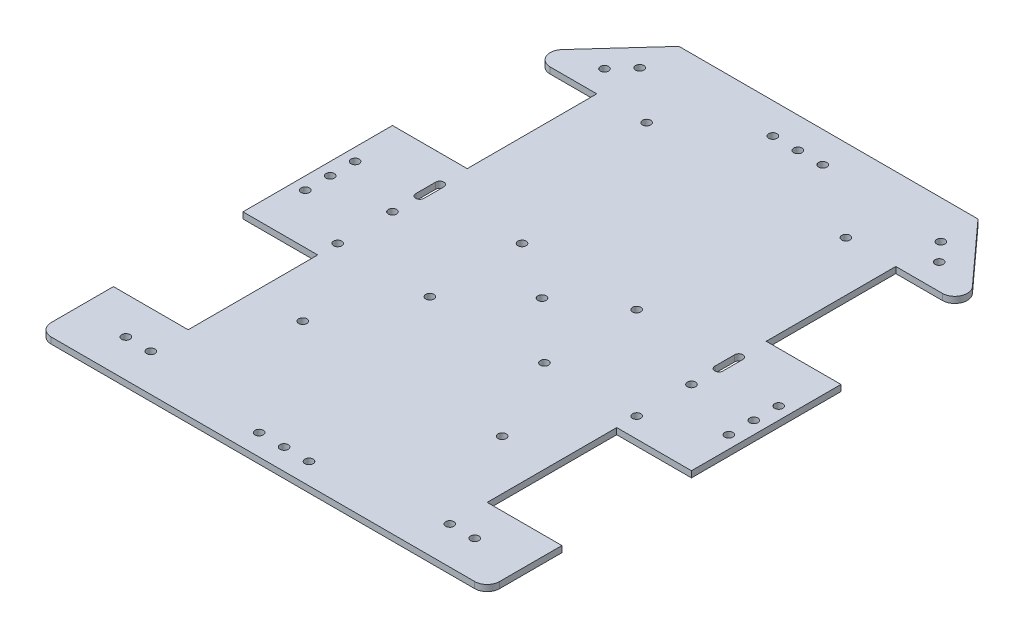
from build123d import *

# Parameters (mm, degrees)
BOSS_EXTRUDE1_DEPTH = 2.5
FILLET1_R           = 5
FILLET2_R           = 5
SKETCH2_R           = 1.65
CUT_EXTRUDE1_DEPTH  = 232.152006264
SKETCH3_R           = 1.65
CUT_EXTRUDE2_DEPTH  = 10
SKETCH4_R           = 1.65
CUT_EXTRUDE3_DEPTH  = 10
SKETCH5_R           = 1.65
CUT_EXTRUDE4_DEPTH  = 10
SKETCH6_R           = 1.65
CUT_EXTRUDE5_DEPTH  = 10
SKETCH8_R           = 1.65
CUT_EXTRUDE6_DEPTH  = 10
SKETCH9_R           = 1.65
CUT_EXTRUDE7_DEPTH  = 10


with BuildPart() as part:
    # Sketch1 → Boss-Extrude1 (new body)
    with BuildSketch(Plane(origin=(0, 0, 0), x_dir=(1, 0, 0), z_dir=(0, 1, 0))):
        Polygon((0, 0), (0, 60), (30, 60), (30, 112), (0, 112), (30, 145), (150, 145), (180, 112), (150, 112), (150, 60), (180, 60), (180, 0), (150, 0), (150, -52), (180, -52), (180, -82), (0, -82), (0, -52), (30, -52), (30, 0), align=None)
    extrude(amount=BOSS_EXTRUDE1_DEPTH)

    # Fillet1
    fillet1_edges = [part.edges().sort_by_distance(p)[0] for p in [
        (180, 1.25, 82),
        (0, 1.25, 82),
    ]]
    fillet(fillet1_edges, radius=FILLET1_R)

    # Fillet2
    fillet2_edges = [part.edges().sort_by_distance(p)[0] for p in [
        (0, 1.25, -112),
        (180, 1.25, -112),
    ]]
    fillet(fillet2_edges, radius=FILLET2_R)

    # Sketch2 → Cut-Extrude1 (cut, through all)
    with BuildSketch(Plane(origin=(0, 2.5, 0), x_dir=(1, 0, 0), z_dir=(0, 1, 0))):
        with Locations(Location((30, 30, 0), (0, 0, 270))):
            Circle(SKETCH2_R)
        with Locations(Location((30, -67, 0), (0, 0, 270))):
            Circle(SKETCH2_R)
        with Locations(Location((50, 112, 0), (0, 0, 270))):
            Circle(SKETCH2_R)
        with Locations(Location((50, -26, 0), (0, 0, 270))):
            Circle(SKETCH2_R)
        with Locations(Location((150, -67, 0), (0, 0, 90))):
            Circle(SKETCH2_R)
        with Locations(Location((130, -26, 0), (0, 0, 90))):
            Circle(SKETCH2_R)
        with Locations(Location((150, 30, 0), (0, 0, 90))):
            Circle(SKETCH2_R)
        with Locations(Location((130, 112, 0), (0, 0, 90))):
            Circle(SKETCH2_R)
        with Locations(Location((20, -67, 0), (0, 0, 270))):
            Circle(SKETCH2_R)
        with Locations(Location((160, -67, 0), (0, 0, 90))):
            Circle(SKETCH2_R)
        with BuildLine():
            Line((28.35, 41), (28.35, 49))
            ThreePointArc((28.35, 49), (30, 50.65), (31.65, 49))
            Line((31.65, 49), (31.65, 41))
            ThreePointArc((31.65, 41), (30, 39.35), (28.35, 41))
        make_face()
        with BuildLine():
            Line((151.65, 41), (151.65, 49))
            ThreePointArc((151.65, 49), (150, 50.65), (148.35, 49))
            Line((148.35, 49), (148.35, 41))
            ThreePointArc((148.35, 41), (150, 39.35), (151.65, 41))
        make_face()
    extrude(amount=-CUT_EXTRUDE1_DEPTH, mode=Mode.SUBTRACT)

    # Sketch3 → Cut-Extrude2 (cut)
    with BuildSketch(Plane(origin=(0, 2.5, 0), x_dir=(1, 0, 0), z_dir=(0, 1, 0))):
        with Locations(Location((90, 132.681681985, 0), (0, 0, 270))):
            Circle(SKETCH3_R)
        with Locations(Location((80, 132.681681985, 0), (0, 0, 270))):
            Circle(SKETCH3_R)
        with Locations(Location((100, 132.681681985, 0), (0, 0, 90))):
            Circle(SKETCH3_R)
    extrude(amount=-CUT_EXTRUDE2_DEPTH, mode=Mode.SUBTRACT)

    # Sketch4 → Cut-Extrude3 (cut)
    with BuildSketch(Plane(origin=(0, 2.5, 0), x_dir=(1, 0, 0), z_dir=(0, 1, 0))):
        with Locations(Location((90, -73.500427327, 0), (0, 0, 270))):
            Circle(SKETCH4_R)
        with Locations(Location((80, -73.500427327, 0), (0, 0, 270))):
            Circle(SKETCH4_R)
        with Locations(Location((100, -73.500427327, 0), (0, 0, 90))):
            Circle(SKETCH4_R)
    extrude(amount=-CUT_EXTRUDE3_DEPTH, mode=Mode.SUBTRACT)

    # Sketch5 → Cut-Extrude4 (cut)
    with BuildSketch(Plane(origin=(0, 2.5, 0), x_dir=(1, 0, 0), z_dir=(0, 1, 0))):
        with Locations(Location((5, 30, 0), (0, 0, 270))):
            Circle(SKETCH5_R)
        with Locations(Location((5, 40, 0), (0, 0, 270))):
            Circle(SKETCH5_R)
        with Locations(Location((5, 20, 0), (0, 0, 270))):
            Circle(SKETCH5_R)
        with Locations(Location((175, 20, 0), (0, 0, 90))):
            Circle(SKETCH5_R)
        with Locations(Location((175, 30, 0), (0, 0, 90))):
            Circle(SKETCH5_R)
        with Locations(Location((175, 40, 0), (0, 0, 90))):
            Circle(SKETCH5_R)
    extrude(amount=-CUT_EXTRUDE4_DEPTH, mode=Mode.SUBTRACT)

    # Sketch6 → Cut-Extrude5 (cut)
    with BuildSketch(Plane(origin=(0, 2.5, 0), x_dir=(1, 0, 0), z_dir=(0, 1, 0))):
        with Locations(Location((90, 30, 0), (0, 0, 270))):
            Circle(SKETCH6_R)
    extrude(amount=-CUT_EXTRUDE5_DEPTH, mode=Mode.SUBTRACT)

    # Sketch8 → Cut-Extrude6 (cut)
    with BuildSketch(Plane(origin=(0, 2.5, 0), x_dir=(1, 0, 0), z_dir=(0, 1, 0))):
        with Locations(Location((29.564293781, 129.654654412, 0), (0, 0, 270))):
            Circle(SKETCH8_R)
        with Locations(Location((22.837565841, 122.255253678, 0), (0, 0, 270))):
            Circle(SKETCH8_R)
        with Locations(Location((157.162434159, 122.255253678, 0), (0, 0, 90))):
            Circle(SKETCH8_R)
        with Locations(Location((150.435706219, 129.654654412, 0), (0, 0, 90))):
            Circle(SKETCH8_R)
    extrude(amount=-CUT_EXTRUDE6_DEPTH, mode=Mode.SUBTRACT)

    # Sketch9 → Cut-Extrude7 (cut)
    with BuildSketch(Plane(origin=(0, 2.5, 0), x_dir=(1, 0, 0), z_dir=(0, 1, 0))):
        with Locations(Location((30, 7.996739715, 0), (0, 0, 270))):
            Circle(SKETCH9_R)
        with Locations(Location((67, 44.996739715, 0), (0, 0, 270))):
            Circle(SKETCH9_R)
        with Locations(Location((67, 7.996739715, 0), (0, 0, 270))):
            Circle(SKETCH9_R)
        with Locations(Location((150, 7.996739715, 0), (0, 0, 90))):
            Circle(SKETCH9_R)
        with Locations(Location((113, 7.996739715, 0), (0, 0, 90))):
            Circle(SKETCH9_R)
        with Locations(Location((113, 44.996739715, 0), (0, 0, 90))):
            Circle(SKETCH9_R)
    extrude(amount=-CUT_EXTRUDE7_DEPTH, mode=Mode.SUBTRACT)


solid = part.part
